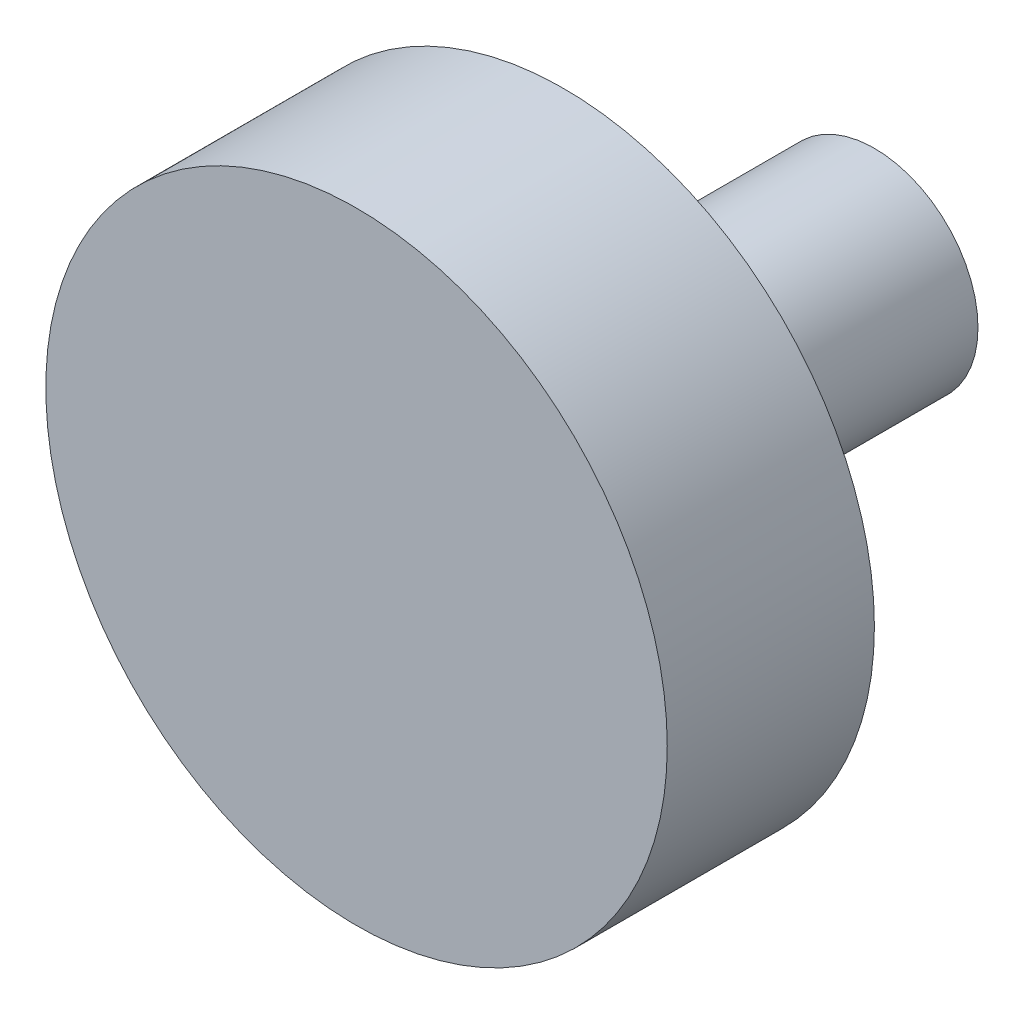
from build123d import *

# Parameters (mm, degrees)
SKETCH1_R           = 2.5
BOSS_EXTRUDE1_DEPTH = 7.5
SKETCH2_R           = 7.5
BOSS_EXTRUDE4_DEPTH = 5


with BuildPart() as part:
    # Sketch1 → Boss-Extrude1 (new body)
    with BuildSketch(Plane.XY):
        Circle(SKETCH1_R)
    extrude(amount=BOSS_EXTRUDE1_DEPTH)

    # Sketch2 → Boss-Extrude4 (add)
    with BuildSketch(Plane.XY.offset(7.5)):
        Circle(SKETCH2_R)
    extrude(amount=BOSS_EXTRUDE4_DEPTH)


solid = part.part
